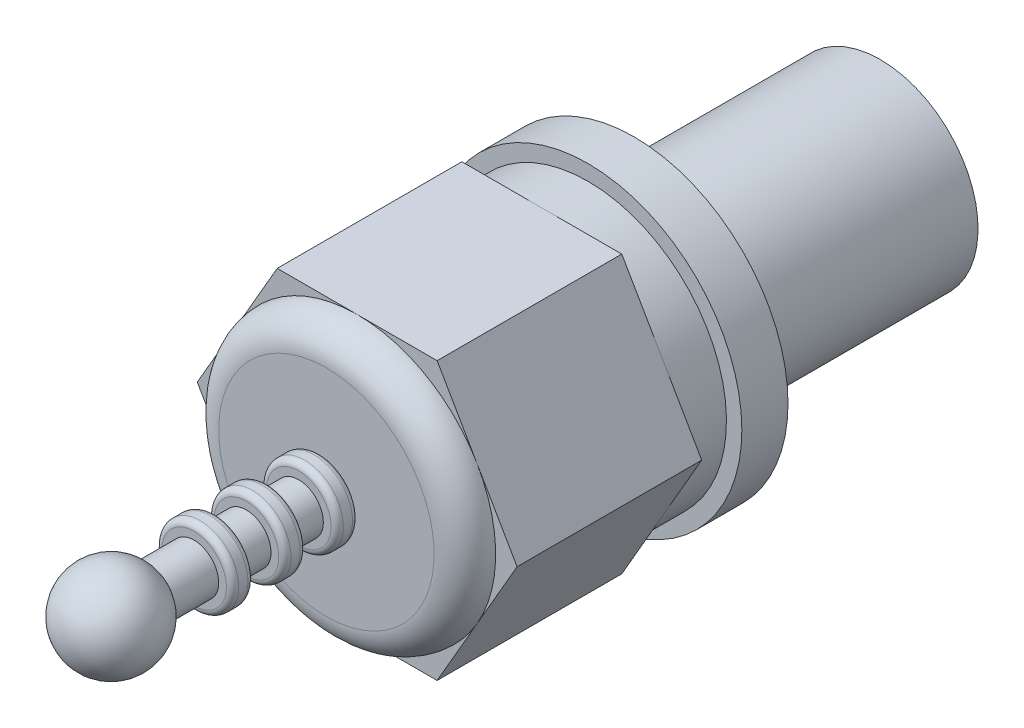
from build123d import *

# Parameters (mm, degrees)
BOSS_EXTRUDE1_DEPTH = 6


with BuildPart() as part:
    # Sketch1 → Revolve1 (revolve)
    with BuildSketch(Plane(origin=(0, 0, 0), x_dir=(0, 0, -1), z_dir=(1, 0, 0))):
        with BuildLine():
            Line((17, 0), (17, 3.175))
            Line((17, 3.175), (9, 3.175))
            Line((9, 3.175), (9, 5))
            Line((9, 5), (7.5, 5))
            Line((7.5, 5), (7.5, 4.5))
            Line((7.5, 4.5), (0, 4.5))
            ThreePointArc((0, 4.5), (-0.707106781, 4.207106781), (-1, 3.5))
            Line((-1, 3.5), (-1, 0.8))
            Line((-1, 0.8), (-1.2, 0.8))
            Line((-1.2, 0.8), (-1.2, 1.05))
            ThreePointArc((-1.2, 1.05), (-1.258578644, 1.191421356), (-1.4, 1.25))
            Line((-1.4, 1.25), (-1.7, 1.25))
            ThreePointArc((-1.7, 1.25), (-1.841421356, 1.191421356), (-1.9, 1.05))
            Line((-1.9, 1.05), (-1.9, 0.8))
            Line((-1.9, 0.8), (-2.9, 0.8))
            Line((-2.9, 0.8), (-2.9, 1.05))
            ThreePointArc((-2.9, 1.05), (-2.958578644, 1.191421356), (-3.1, 1.25))
            Line((-3.1, 1.25), (-3.4, 1.25))
            ThreePointArc((-3.4, 1.25), (-3.541421356, 1.191421356), (-3.6, 1.05))
            Line((-3.6, 1.05), (-3.6, 0.8))
            Line((-3.6, 0.8), (-4.6, 0.8))
            Line((-4.6, 0.8), (-4.6, 1.05))
            ThreePointArc((-4.6, 1.05), (-4.658578644, 1.191421356), (-4.8, 1.25))
            Line((-4.8, 1.25), (-5.1, 1.25))
            ThreePointArc((-5.1, 1.25), (-5.241421356, 1.191421356), (-5.3, 1.05))
            Line((-5.3, 1.05), (-5.3, 0.8))
            Line((-5.3, 0.8), (-6.731142246, 0.8))
            ThreePointArc((-6.731142246, 0.8), (-8.416361243, 1.441056319), (-9.5, 0))
            Line((-9.5, 0), (17, 0))
        make_face()
    revolve(axis=Axis((0, 0, -17), (0, 0, 1)))

    # Sketch2 → Boss-Extrude1 (add)
    with BuildSketch(Plane.XY):
        Polygon((-2.598076211, 4.5), (-5.196152423, 0), (-2.598076211, -4.5), (2.598076211, -4.5), (5.196152423, 0), (2.598076211, 4.5), align=None)
    extrude(amount=-BOSS_EXTRUDE1_DEPTH)


solid = part.part
